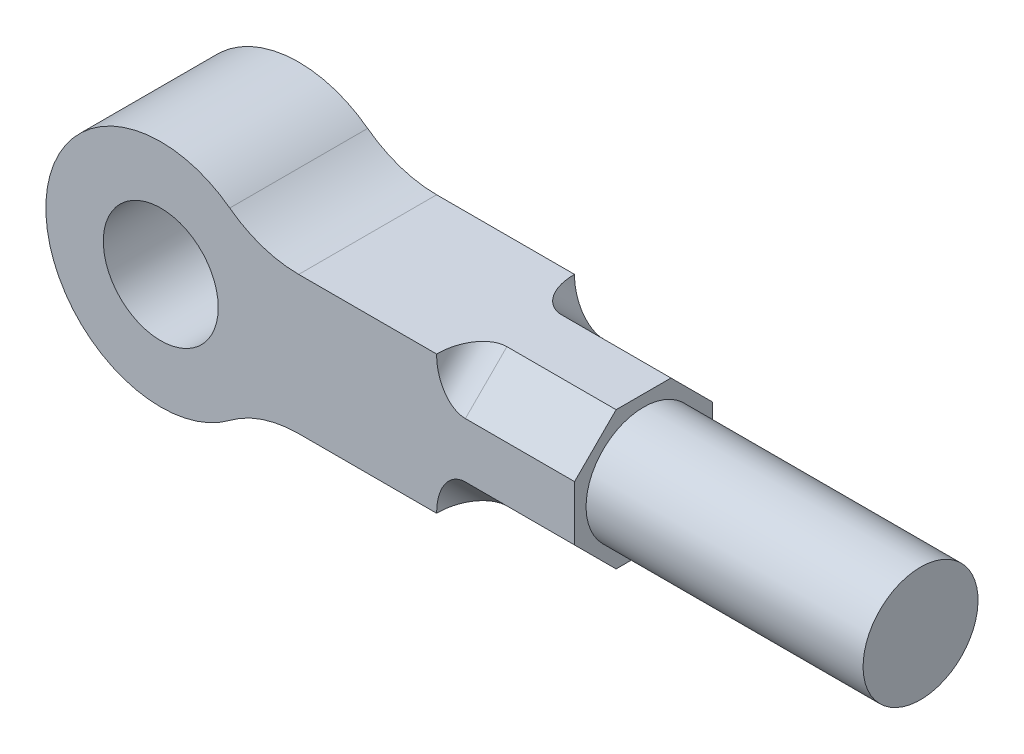
from build123d import *

# Parameters (mm, degrees)
SKETCH1_R           = 25
BOSS_EXTRUDE1_DEPTH = 30
CUT_EXTRUDE1_DEPTH  = 60
SKETCH2_3_R         = 25
BOSS_EXTRUDE2_DEPTH = 120.5
FILLET1_R           = 12.5


with BuildPart() as part:
    # Sketch1 → Boss-Extrude1 (new, symmetric)
    with BuildSketch(Plane.XY):
        with BuildLine():
            Line((60, 30), (180, 30))
            Line((180, 30), (180, -30))
            Line((180, -30), (60, -30))
            ThreePointArc((60, -30), (44.188611699, -32.565835097), (30, -40))
            ThreePointArc((30, -40), (-50, 0), (30, 40))
            ThreePointArc((30, 40), (44.188611699, 32.565835097), (60, 30))
        make_face()
        Circle(SKETCH1_R, mode=Mode.SUBTRACT)
    extrude(amount=BOSS_EXTRUDE1_DEPTH, both=True)

    # Sketch2 → Cut-Extrude1 (cut)
    with BuildSketch(Plane(origin=(180, 0, 0), x_dir=(0, 0, -1), z_dir=(1, 0, 0))):
        Polygon((11.94, 30), (30, 11.94), (30, 30), align=None)
        Polygon((30, -30), (30, -11.94), (11.94, -30), align=None)
        Polygon((-30, 11.94), (-11.94, 30), (-30, 30), align=None)
        Polygon((-30, -30), (-11.94, -30), (-30, -11.94), align=None)
    extrude(amount=-CUT_EXTRUDE1_DEPTH, mode=Mode.SUBTRACT)

    # Sketch2<3> → Boss-Extrude2 (add)
    with BuildSketch(Plane(origin=(180, 0, 0), x_dir=(0, 0, -1), z_dir=(1, 0, 0))):
        Circle(SKETCH2_3_R)
    extrude(amount=BOSS_EXTRUDE2_DEPTH)

    # Fillet1
    fillet1_edges = [part.edges().sort_by_distance(p)[0] for p in [
        (120, -20.97, -20.97),
        (120, 20.97, -20.97),
        (120, -20.97, 20.97),
        (120, 20.97, 20.97),
    ]]
    fillet(fillet1_edges, radius=FILLET1_R)


solid = part.part
